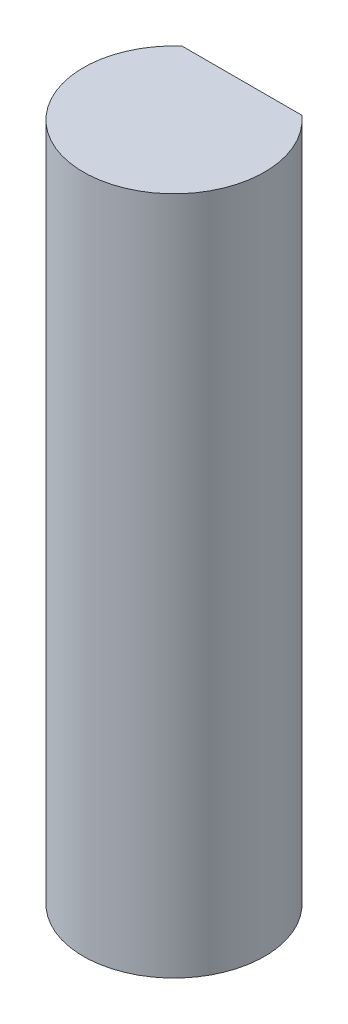
from build123d import *

# Parameters (mm, degrees)
BOSS_EXTRUDE1_DEPTH = 7.5


with BuildPart() as part:
    # Sketch1 → Boss-Extrude1 (new, symmetric)
    with BuildSketch(Plane(origin=(0, 0, 0), x_dir=(1, 0, 0), z_dir=(0, 1, 0))):
        with BuildLine():
            Line((1.322875656, 1.5), (-1.322875656, 1.5))
            ThreePointArc((-1.322875656, 1.5), (0, -2), (1.322875656, 1.5))
        make_face()
    extrude(amount=BOSS_EXTRUDE1_DEPTH, both=True)


solid = part.part
